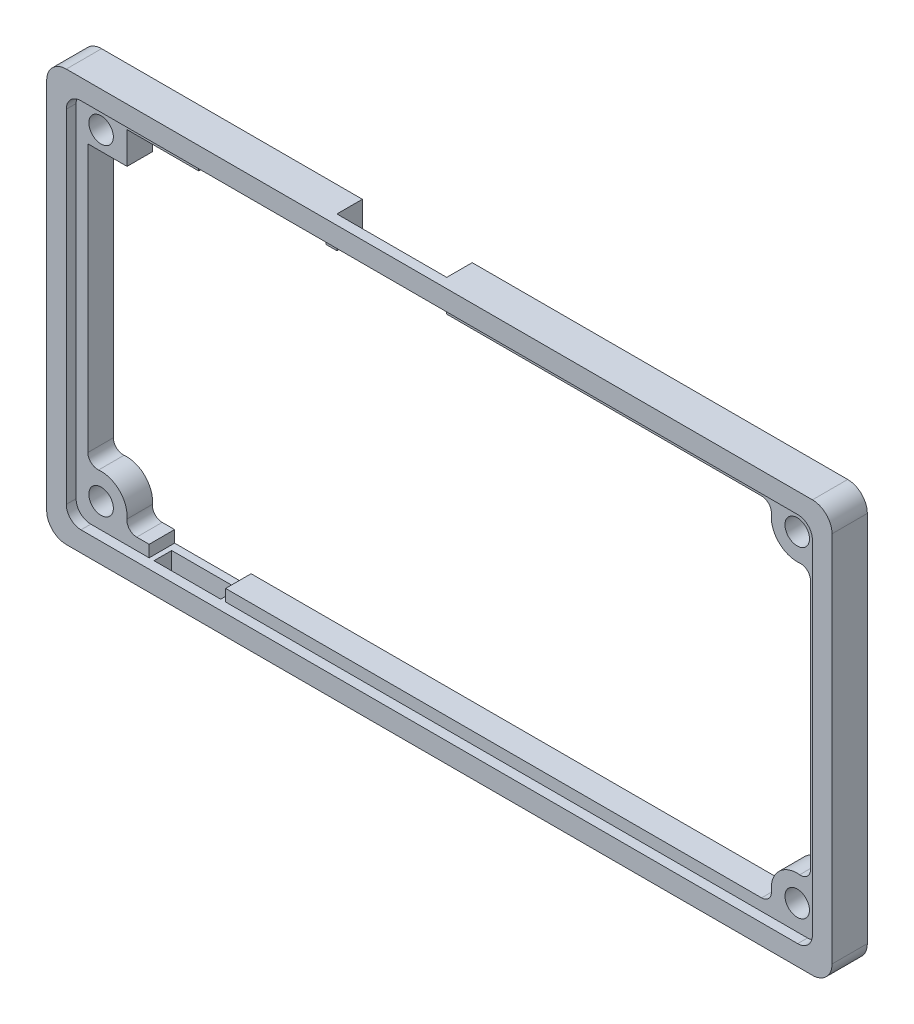
from build123d import *

# Parameters (mm, degrees)
SKETCH1_W           = 80.1
SKETCH1_H           = 42
SKETCH1_R           = 1.25
BOSS_EXTRUDE1_DEPTH = 2.6
SKETCH2_W           = 80.1
SKETCH2_H           = 42
SKETCH2_W_2         = 76.1
SKETCH2_H_2         = 37.9
BOSS_EXTRUDE2_DEPTH = 1
FILLET1_R           = 2
FILLET2_R           = 1.5
SKETCH3_W           = 13
SKETCH3_H           = 5.85
CUT_EXTRUDE1_DEPTH  = 49.913903954
SKETCH4_W           = 7.8
SKETCH4_H           = 1.2
CUT_EXTRUDE2_DEPTH  = 49.913903954
SKETCH5_W           = 6.8
SKETCH5_H           = 1.8
CUT_USB_DEPTH       = 4
SKETCH6_W           = 11.2
SKETCH6_H           = 3.25
CUT_PILL_DEPTH      = 2.6


with BuildPart() as part:
    # Sketch1 → Boss-Extrude1 (new body)
    with BuildSketch(Plane.XY):
        with Locations((4.05, 0)):
            Rectangle(SKETCH1_W, SKETCH1_H)
        with Locations((39.55, -16.4)):
            Circle(SKETCH1_R, mode=Mode.SUBTRACT)
        with Locations(Location((-31.45, -16.4, 0), (0, 0, 180))):
            Circle(SKETCH1_R, mode=Mode.SUBTRACT)
        with Locations(Location((39.55, 16.4, 0), (0, 0, 180))):
            Circle(SKETCH1_R, mode=Mode.SUBTRACT)
        with Locations((-31.45, 16.4)):
            Circle(SKETCH1_R, mode=Mode.SUBTRACT)
        with BuildLine():
            Line((35.916819575, -17.75), (-27.816819575, -17.75))
            ThreePointArc((-27.816819575, -17.75), (-28.557052785, -17.422350202), (-28.812211472, -16.654109589))
            ThreePointArc((-28.812211472, -16.654109589), (-29.57616703, -14.52616703), (-31.704109589, -13.762211472))
            ThreePointArc((-31.704109589, -13.762211472), (-32.472350202, -13.507052785), (-32.8, -12.766819575))
            Line((-32.8, -12.766819575), (-32.8, 14.5))
            Line((-32.8, 14.5), (-28.8, 14.5))
            Line((-28.8, 14.5), (-28.8, 17.75))
            Line((-28.8, 17.75), (-27.816819575, 17.75))
            Line((-27.816819575, 17.75), (35.916819575, 17.75))
            ThreePointArc((35.916819575, 17.75), (36.657052785, 17.422350202), (36.912211472, 16.654109589))
            ThreePointArc((36.912211472, 16.654109589), (37.67616703, 14.52616703), (39.804109589, 13.762211472))
            ThreePointArc((39.804109589, 13.762211472), (40.572350202, 13.507052785), (40.9, 12.766819575))
            Line((40.9, 12.766819575), (40.9, -12.766819575))
            ThreePointArc((40.9, -12.766819575), (40.572350202, -13.507052785), (39.804109589, -13.762211472))
            ThreePointArc((39.804109589, -13.762211472), (37.67616703, -14.52616703), (36.912211472, -16.654109589))
            ThreePointArc((36.912211472, -16.654109589), (36.657052785, -17.422350202), (35.916819575, -17.75))
        make_face(mode=Mode.SUBTRACT)
    extrude(amount=BOSS_EXTRUDE1_DEPTH)

    # Sketch2 → Boss-Extrude2 (add)
    with BuildSketch(Plane.XY.offset(2.6)):
        with Locations((4.05, 0)):
            Rectangle(SKETCH2_W, SKETCH2_H)
        with Locations((4.05, 0)):
            Rectangle(SKETCH2_W_2, SKETCH2_H_2, mode=Mode.SUBTRACT)
    extrude(amount=BOSS_EXTRUDE2_DEPTH)

    # Fillet1
    fillet1_edges = [part.edges().sort_by_distance(p)[0] for p in [
        (44.1, -21, 1.8),
        (-36, -21, 1.8),
        (-36, 21, 1.8),
        (44.1, 21, 1.8),
    ]]
    fillet(fillet1_edges, radius=FILLET1_R)

    # Fillet2
    fillet2_edges = [part.edges().sort_by_distance(p)[0] for p in [
        (-34, -18.95, 3.1),
        (42.1, -18.95, 3.1),
        (42.1, 18.95, 3.1),
        (-34, 18.95, 3.1),
    ]]
    fillet(fillet2_edges, radius=FILLET2_R)

    # Sketch3 → Cut-Extrude1 (cut, through all)
    with BuildSketch(Plane.XY.offset(2.6)):
        with Locations((-15, 16.025)):
            Rectangle(SKETCH3_W, SKETCH3_H)
    extrude(amount=-CUT_EXTRUDE1_DEPTH, mode=Mode.SUBTRACT)

    # Sketch4 → Cut-Extrude2 (cut, through all)
    with BuildSketch(Plane.XY.offset(2.6)):
        with Locations((-22.65, -18.35)):
            Rectangle(SKETCH4_W, SKETCH4_H)
    extrude(amount=-CUT_EXTRUDE2_DEPTH, mode=Mode.SUBTRACT)

    # Sketch5 → Cut-USB (cut)
    with BuildSketch(Plane.XZ.offset(21)):
        with Locations((-22.65, 1.7)):
            Rectangle(SKETCH5_W, SKETCH5_H)
    extrude(amount=-CUT_USB_DEPTH, mode=Mode.SUBTRACT)

    # Sketch6 → Cut-Pill (cut)
    with BuildSketch(Plane(origin=(0, 0, 0), x_dir=(-1, 0, 0), z_dir=(0, 0, -1))):
        with Locations((1.8, 19.375)):
            Rectangle(SKETCH6_W, SKETCH6_H)
    extrude(amount=-CUT_PILL_DEPTH, mode=Mode.SUBTRACT)


solid = part.part
